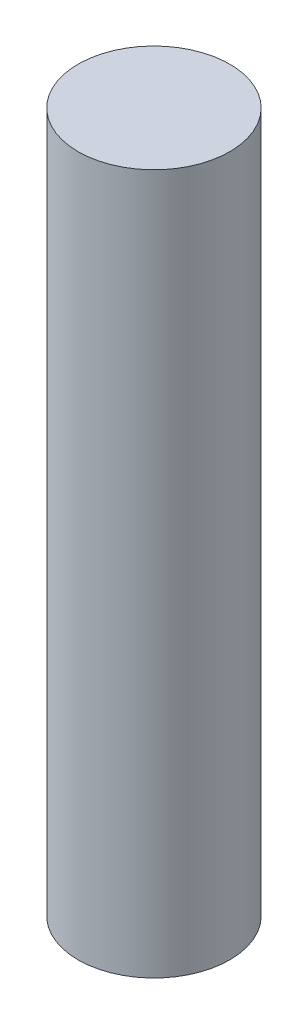
from build123d import *

# Parameters (mm, degrees)
SKETCH1_R           = 32.5
BOSS_EXTRUDE1_DEPTH = 300
SKETCH2_W           = 14
SKETCH2_H           = 44
CUT_EXTRUDE1_DEPTH  = 10


with BuildPart() as part:
    # Sketch1 → Boss-Extrude1 (new body)
    with BuildSketch(Plane(origin=(0, 0, 0), x_dir=(1, 0, 0), z_dir=(0, 1, 0))):
        Circle(SKETCH1_R)
    extrude(amount=BOSS_EXTRUDE1_DEPTH)

    # Sketch2 → Cut-Extrude1 (cut)
    with BuildSketch(Plane.ZY.offset(32.5)):
        with Locations((0, 251.6)):
            Rectangle(SKETCH2_W, SKETCH2_H)
    extrude(amount=-CUT_EXTRUDE1_DEPTH, mode=Mode.SUBTRACT)


solid = part.part
